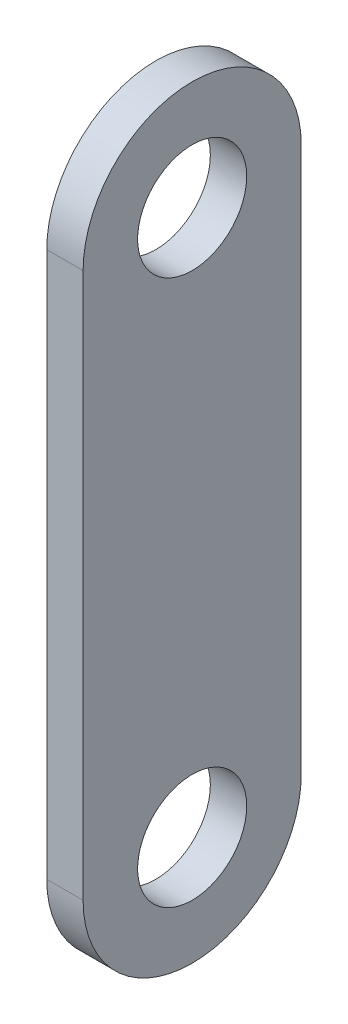
from build123d import *

# Parameters (mm, degrees)
SKETCH1_R           = 15
BOSS_EXTRUDE1_DEPTH = 10


with BuildPart() as part:
    # Sketch1 → Boss-Extrude1 (new body)
    with BuildSketch(Plane.YZ):
        with BuildLine():
            Line((0, 30), (150, 30))
            ThreePointArc((150, 30), (180, 0), (150, -30))
            Line((150, -30), (0, -30))
            ThreePointArc((0, -30), (-30, 0), (0, 30))
        make_face()
        Circle(SKETCH1_R, mode=Mode.SUBTRACT)
        with Locations((150, 0)):
            Circle(SKETCH1_R, mode=Mode.SUBTRACT)
    extrude(amount=BOSS_EXTRUDE1_DEPTH)


solid = part.part
